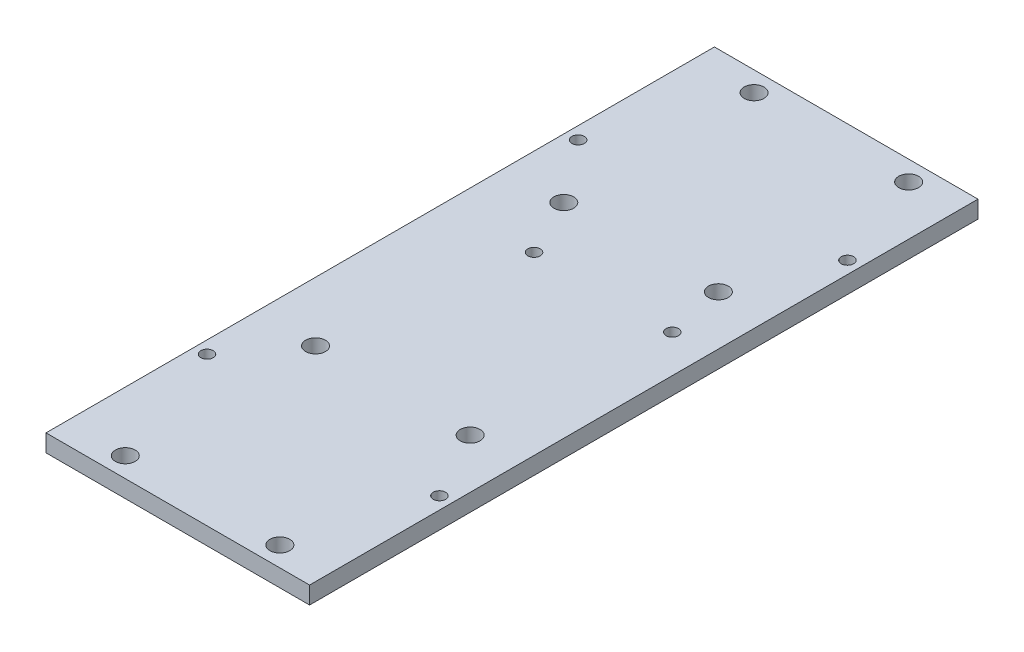
from build123d import *

# Parameters (mm, degrees)
SKETCH1_W                                = 53.2
SKETCH1_H                                = 134.9
SKETCH1_R                                = 1.25
BOSS_EXTRUDE1_DEPTH                      = 3.5
POLOLU_MOUNTING_BRACKET_R                = 2
POLOLU_37MM_MOUNTING_BRACKET_HOLES_DEPTH = 146.053438429


with BuildPart() as part:
    # Sketch1 → Boss-Extrude1 (new body)
    with BuildSketch(Plane(origin=(0, 0, 0), x_dir=(1, 0, 0), z_dir=(0, 1, 0))):
        with Locations((-26.6, 67.45)):
            Rectangle(SKETCH1_W, SKETCH1_H)
        with Locations(Location((-50.7, 104.9, 0), (0, 0, 270))):
            Circle(SKETCH1_R, mode=Mode.SUBTRACT)
        with Locations(Location((-2.5, 111.05, 0), (0, 0, 270))):
            Circle(SKETCH1_R, mode=Mode.SUBTRACT)
        with Locations(Location((-35.5, 80.8, 0), (0, 0, 270))):
            Circle(SKETCH1_R, mode=Mode.SUBTRACT)
        with Locations(Location((-7.6, 80.8, 0), (0, 0, 270))):
            Circle(SKETCH1_R, mode=Mode.SUBTRACT)
        with Locations(Location((-50.7, 30, 0), (0, 0, 270))):
            Circle(SKETCH1_R, mode=Mode.SUBTRACT)
        with Locations(Location((-2.5, 28.7, 0), (0, 0, 270))):
            Circle(SKETCH1_R, mode=Mode.SUBTRACT)
    extrude(amount=BOSS_EXTRUDE1_DEPTH)

    # Pololu Mounting Bracket → Pololu 37mm mounting bracket holes (cut, through all)
    with BuildSketch(Plane(origin=(0, 3.5, 0), x_dir=(1, 0, 0), z_dir=(0, 1, 0))):
        with Locations(Location((-41.2, 4, 0), (0, 0, 270))):
            Circle(POLOLU_MOUNTING_BRACKET_R)
        with Locations(Location((-10, 4, 0), (0, 0, 270))):
            Circle(POLOLU_MOUNTING_BRACKET_R)
        with Locations(Location((-41.2, 42.4, 0), (0, 0, 270))):
            Circle(POLOLU_MOUNTING_BRACKET_R)
        with Locations(Location((-10, 42.4, 0), (0, 0, 270))):
            Circle(POLOLU_MOUNTING_BRACKET_R)
        with Locations(Location((-41.2, 130.9, 0), (0, 0, 90))):
            Circle(POLOLU_MOUNTING_BRACKET_R)
        with Locations(Location((-10, 130.9, 0), (0, 0, 90))):
            Circle(POLOLU_MOUNTING_BRACKET_R)
        with Locations(Location((-10, 92.5, 0), (0, 0, 90))):
            Circle(POLOLU_MOUNTING_BRACKET_R)
        with Locations(Location((-41.2, 92.5, 0), (0, 0, 90))):
            Circle(POLOLU_MOUNTING_BRACKET_R)
    extrude(amount=-POLOLU_37MM_MOUNTING_BRACKET_HOLES_DEPTH, mode=Mode.SUBTRACT)


solid = part.part
